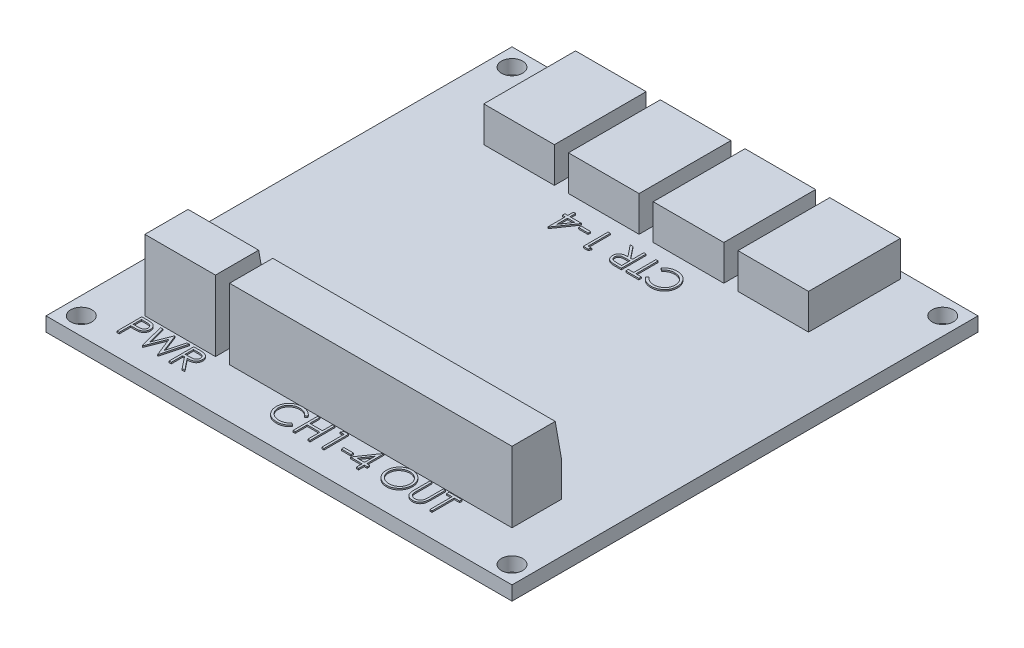
from build123d import *
from OCP.BRepFilletAPI import BRepFilletAPI_MakeChamfer

# Parameters (mm, degrees)
SKIZZE1_W                       = 66
SKIZZE1_H                       = 66
SKIZZE1_R                       = 1.5
AUFSATZ_LINEAR_AUSTRAGEN1_DEPTH = 2
SKIZZE2_W                       = 40
SKIZZE2_H                       = 7
SKIZZE2_W_2                     = 10
AUFSATZ_LINEAR_AUSTRAGEN2_DEPTH = 10
FASE1_SIZE                      = 5
FASE1_SIZE2                     = 0.881634904
SKIZZE3_W                       = 1.346153846
SKIZZE3_H                       = 0.358974359
AUFSATZ_LINEAR_AUSTRAGEN3_DEPTH = 0.2
SKIZZE4_W                       = 10
SKIZZE4_H                       = 13
AUFSATZ_LINEAR_AUSTRAGEN4_DEPTH = 5
SKIZZE5_W                       = 1.346153846
SKIZZE5_H                       = 0.358974359
AUFSATZ_LINEAR_AUSTRAGEN5_DEPTH = 0.2


with BuildPart() as part:
    # Skizze1 → Aufsatz-Linear austragen1 (new body)
    with BuildSketch(Plane(origin=(0, 0, 0), x_dir=(1, 0, 0), z_dir=(0, 1, 0))):
        Rectangle(SKIZZE1_W, SKIZZE1_H)
        with Locations(Location((-30.5, 30.5, 0), (0, 0, 270))):
            Circle(SKIZZE1_R, mode=Mode.SUBTRACT)
        with Locations(Location((-30.5, -30.5, 0), (0, 0, 90))):
            Circle(SKIZZE1_R, mode=Mode.SUBTRACT)
        with Locations(Location((30.5, 30.5, 0), (0, 0, 90))):
            Circle(SKIZZE1_R, mode=Mode.SUBTRACT)
        with Locations(Location((30.5, -30.5, 0), (0, 0, 270))):
            Circle(SKIZZE1_R, mode=Mode.SUBTRACT)
    extrude(amount=AUFSATZ_LINEAR_AUSTRAGEN1_DEPTH)

    # Skizze2 → Aufsatz-Linear austragen2 (add)
    with BuildSketch(Plane(origin=(0, 2, 0), x_dir=(1, 0, 0), z_dir=(0, 1, 0))):
        with Locations((6, -22.5)):
            Rectangle(SKIZZE2_W, SKIZZE2_H)
        with Locations((-21, -22.5)):
            Rectangle(SKIZZE2_W_2, SKIZZE2_H)
    extrude(amount=AUFSATZ_LINEAR_AUSTRAGEN2_DEPTH)

    # Fase1: one chamfer whose edges measure the first distance from different faces: ONE call of the kernel's chamfer builder (chamfer() names one face for all edges)
    fase1_edges_1 = [part.edges().sort_by_distance(p)[0] for p in [
        (6, 12, 19),
    ]]
    fase1_side_1 = [part.faces().sort_by_distance(p)[0] for p in [
        (6, 7, 19),
    ]]
    fase1_edges_2 = [part.edges().sort_by_distance(p)[0] for p in [
        (-21, 12, 19),
    ]]
    fase1_side_2 = [part.faces().sort_by_distance(p)[0] for p in [
        (-21, 7, 19),
    ]]
    fase1 = BRepFilletAPI_MakeChamfer(part.part.solid().wrapped)
    for e in fase1_edges_1:
        fase1.Add(FASE1_SIZE, FASE1_SIZE2, e.wrapped, fase1_side_1[0].wrapped)  # the first distance lies on this face
    for e in fase1_edges_2:
        fase1.Add(FASE1_SIZE, FASE1_SIZE2, e.wrapped, fase1_side_2[0].wrapped)  # the first distance lies on this face
    add(Compound.cast(fase1.Shape()), mode=Mode.REPLACE)

    # Skizze3 → Aufsatz-Linear austragen3 (add)
    # profile 1 of 11: a face of its own
    with BuildSketch(Plane(origin=(0, 2, 0), x_dir=(1, 0, 0), z_dir=(0, 1, 0))):
        with BuildLine():
            Line((-25.905505706, -26.527836459), (-25.219107469, -26.527836459))
            add(Edge.make_bspline(
                [(-25.219107469, -26.527836459), (-25.171896563, -26.527888355), (-25.08143837, -26.527987791), (-24.951723315, -26.531002536), (-24.833913583, -26.535029228), (-24.728263202, -26.540611122), (-24.634447104, -26.547207712), (-24.552889804, -26.556459751), (-24.482950248, -26.566120047), (-24.441043799, -26.575941453), (-24.421931988, -26.580420593)],
                knots=[0, 0, 0, 0, 1.415646017, 2.712440637, 3.8905458, 4.950247383, 5.884950622, 6.709939814, 7.411656543, 8, 8, 8, 8], degree=3))
            add(Edge.make_bspline(
                [(-24.421931988, -26.580420593), (-24.397738455, -26.587042543), (-24.349921477, -26.600130405), (-24.281020434, -26.626344128), (-24.215466589, -26.657426294), (-24.15303503, -26.692850233), (-24.094492947, -26.734135798), (-24.038966906, -26.779609415), (-23.986946926, -26.830320984), (-23.938725534, -26.885701724), (-23.894440737, -26.944821934), (-23.856311054, -27.008564164), (-23.824383827, -27.075855467), (-23.797000555, -27.146649038), (-23.777292101, -27.221539362), (-23.762445201, -27.300006074), (-23.753021574, -27.382040764), (-23.752119012, -27.438100632), (-23.751659553, -27.466638542)],
                knots=[0, 0, 0, 0, 0.999701418, 1.975846123, 2.934577507, 3.890451536, 4.834027766, 5.787354733, 6.749476667, 7.726910423, 8.712836071, 9.690891519, 10.682875813, 11.679750201, 12.712814741, 13.765529915, 14.8625177, 16, 16, 16, 16], degree=3))
            add(Edge.make_bspline(
                [(-23.751659553, -27.466638542), (-23.752080977, -27.495416319), (-23.752905523, -27.551721983), (-23.762801809, -27.634094771), (-23.776132, -27.712813161), (-23.796629052, -27.787702612), (-23.823474726, -27.858318382), (-23.854966778, -27.925739614), (-23.892950309, -27.988819286), (-23.936595138, -28.047786404), (-23.985146733, -28.102696316), (-24.038399671, -28.15315111), (-24.096138964, -28.198855449), (-24.158181112, -28.239911793), (-24.22513096, -28.275368072), (-24.295973114, -28.307125377), (-24.37132333, -28.333796438), (-24.423465844, -28.347826499), (-24.44997686, -28.354959856)],
                knots=[0, 0, 0, 0, 1.121902311, 2.195077645, 3.232258892, 4.234102512, 5.217864754, 6.176164875, 7.132989551, 8.084763148, 9.034132444, 9.988522005, 10.94243251, 11.903244335, 12.886203696, 13.894208494, 14.929344452, 16, 16, 16, 16], degree=3))
            add(Edge.make_bspline(
                [(-24.44997686, -28.354959856), (-24.471904194, -28.359622837), (-24.519959222, -28.369842031), (-24.599101944, -28.381250488), (-24.69124733, -28.390988089), (-24.79626961, -28.398289227), (-24.914074515, -28.404539595), (-25.044725772, -28.409507689), (-25.188479849, -28.412237543), (-25.288751093, -28.412378336), (-25.341102662, -28.412451843)],
                knots=[0, 0, 0, 0, 0.601384939, 1.31797006, 2.144135048, 3.087295005, 4.142315834, 5.309527816, 6.595305764, 8, 8, 8, 8], degree=3))
            Line((-25.341102662, -28.412451843), (-25.591403142, -28.412451843))
            Line((-25.591403142, -28.412451843), (-25.591403142, -30.027836459))
            Line((-25.591403142, -30.027836459), (-25.905505706, -30.027836459))
            Line((-25.905505706, -30.027836459), (-25.905505706, -26.527836459))
        make_face()
        with BuildLine():
            Line((-25.591403142, -26.886810818), (-25.591403142, -28.053477484))
            Line((-25.591403142, -28.053477484), (-24.978622694, -28.061189824))
            add(Edge.make_bspline(
                [(-24.978622694, -28.061189824), (-24.948702768, -28.061205288), (-24.890942968, -28.06123514), (-24.807506745, -28.057249916), (-24.730097457, -28.052649384), (-24.658952882, -28.04591346), (-24.594040947, -28.036392203), (-24.535253419, -28.026780465), (-24.483046136, -28.012875102), (-24.421946934, -27.994152033), (-24.353863586, -27.962219418), (-24.279796038, -27.915869527), (-24.217025452, -27.856788819), (-24.162707155, -27.790360988), (-24.119601277, -27.716461859), (-24.088045285, -27.637392922), (-24.069504127, -27.553965072), (-24.067017933, -27.496876933), (-24.065762117, -27.468040786)],
                knots=[0, 0, 0, 0, 1.160613943, 2.240541288, 3.23993089, 4.169200891, 5.011653406, 5.7853311, 6.478053781, 7.106038997, 8.262395093, 9.384106736, 10.481365981, 11.59014053, 12.70357646, 13.786202915, 14.881775077, 16, 16, 16, 16], degree=3))
            add(Edge.make_bspline(
                [(-24.065762117, -27.468040786), (-24.067024763, -27.439902272), (-24.069534748, -27.38396639), (-24.088190611, -27.30198763), (-24.119539925, -27.223751925), (-24.16299652, -27.15077884), (-24.21573765, -27.084590036), (-24.277036993, -27.027092909), (-24.346750254, -26.980871206), (-24.411598485, -26.951037924), (-24.469199671, -26.932822649), (-24.519231631, -26.920077808), (-24.575722305, -26.909902202), (-24.638690085, -26.901662699), (-24.707646919, -26.894609238), (-24.783185234, -26.889823261), (-24.865018877, -26.887021805), (-24.921829448, -26.88688285), (-24.951278944, -26.886810818)],
                knots=[0, 0, 0, 0, 1.120700087, 2.227813068, 3.331159281, 4.466773991, 5.599788987, 6.693661531, 7.80175334, 8.91857717, 9.525282508, 10.207424825, 10.974604443, 11.810962634, 12.737642355, 13.736264703, 14.826523623, 16, 16, 16, 16], degree=3))
            Line((-24.951278944, -26.886810818), (-25.591403142, -26.886810818))
        make_face(mode=Mode.SUBTRACT)
    # profile 2 of 11: a face of its own
    with BuildSketch(Plane(origin=(0, 2, 0), x_dir=(1, 0, 0), z_dir=(0, 1, 0))):
        Polygon((-23.258069809, -26.527836459), (-22.933450418, -26.527836459), (-22.248454424, -29.09464335), (-21.229724456, -26.527836459), (-21.18415154, -26.527836459), (-20.18435186, -29.077115305), (-19.495850258, -26.527836459), (-19.174736476, -26.527836459), (-20.118446412, -30.027836459), (-20.163318206, -30.027836459), (-21.216403142, -27.350953446), (-22.28210827, -30.027836459), (-22.326980065, -30.027836459), align=None)
    # profile 3 of 11: a face of its own
    with BuildSketch(Plane(origin=(0, 2, 0), x_dir=(1, 0, 0), z_dir=(0, 1, 0))):
        with BuildLine():
            Line((-18.546531347, -26.527836459), (-17.846110674, -26.527836459))
            add(Edge.make_bspline(
                [(-17.846110674, -26.527836459), (-17.799369546, -26.527992045), (-17.709621401, -26.528290787), (-17.581048131, -26.52995655), (-17.464221034, -26.534730906), (-17.359201195, -26.538839489), (-17.26599054, -26.546331431), (-17.184303249, -26.553492078), (-17.114515551, -26.562865738), (-17.0722697, -26.571571161), (-17.053141924, -26.575512741)],
                knots=[0, 0, 0, 0, 1.410062039, 2.707475311, 3.878576406, 4.937260626, 5.877586885, 6.699081471, 7.410979367, 8, 8, 8, 8], degree=3))
            add(Edge.make_bspline(
                [(-17.053141924, -26.575512741), (-17.0275353, -26.581839506), (-16.976868311, -26.59435807), (-16.903918245, -26.620817671), (-16.834403921, -26.651437295), (-16.768614096, -26.687401016), (-16.706878305, -26.728975795), (-16.648559994, -26.775443918), (-16.593394531, -26.826551124), (-16.543612901, -26.883585965), (-16.496673849, -26.943422475), (-16.457085223, -27.008126232), (-16.422958743, -27.075787759), (-16.395788226, -27.147095177), (-16.373910252, -27.221356949), (-16.358484013, -27.299245745), (-16.349232825, -27.380406721), (-16.34829097, -27.435764629), (-16.347813399, -27.463834055)],
                knots=[0, 0, 0, 0, 1.027469482, 2.033020251, 3.019912614, 3.986113645, 4.951240523, 5.91722682, 6.890402269, 7.87763091, 8.8651537, 9.85103654, 10.82876324, 11.815024772, 12.821070561, 13.842952187, 14.906261191, 16, 16, 16, 16], degree=3))
            add(Edge.make_bspline(
                [(-16.347813399, -27.463834055), (-16.349282397, -27.51046916), (-16.352148793, -27.601466327), (-16.378873896, -27.733527209), (-16.422650416, -27.856716524), (-16.482973705, -27.970879161), (-16.559793181, -28.073789807), (-16.652117972, -28.164180262), (-16.759999583, -28.239820175), (-16.860428899, -28.292272979), (-16.949143099, -28.325865888), (-17.022176412, -28.349502247), (-17.101843389, -28.367764212), (-17.187380724, -28.384124344), (-17.279144379, -28.396476038), (-17.376914419, -28.405522633), (-17.48076057, -28.411176682), (-17.55209964, -28.412018686), (-17.588798976, -28.412451843)],
                knots=[0, 0, 0, 0, 1.260483769, 2.459530307, 3.627416485, 4.787058657, 5.939039949, 7.08810263, 8.267026773, 9.491475466, 10.141966685, 10.831826277, 11.566392101, 12.351337768, 13.187381173, 14.07005841, 15.007169909, 16, 16, 16, 16], degree=3))
            Line((-17.588798976, -28.412451843), (-16.302941604, -30.027836459))
            Line((-16.302941604, -30.027836459), (-16.691363078, -30.027836459))
            Line((-16.691363078, -30.027836459), (-17.97722045, -28.412451843))
            Line((-17.97722045, -28.412451843), (-18.232428783, -28.412451843))
            Line((-18.232428783, -28.412451843), (-18.232428783, -30.027836459))
            Line((-18.232428783, -30.027836459), (-18.546531347, -30.027836459))
            Line((-18.546531347, -30.027836459), (-18.546531347, -26.527836459))
        make_face()
        with BuildLine():
            Line((-18.232428783, -26.886810818), (-18.232428783, -28.053477484))
            Line((-18.232428783, -28.053477484), (-17.591603463, -28.058385337))
            add(Edge.make_bspline(
                [(-17.591603463, -28.058385337), (-17.561683424, -28.058398574), (-17.503689867, -28.05842423), (-17.419789202, -28.054430454), (-17.34166909, -28.049887136), (-17.269628338, -28.04293779), (-17.203634763, -28.033981718), (-17.14372135, -28.022778734), (-17.089790298, -28.009726671), (-17.026891759, -27.989525046), (-16.956655228, -27.957519027), (-16.880323768, -27.910953529), (-16.81532143, -27.85238441), (-16.760403568, -27.785410953), (-16.716274136, -27.711774705), (-16.685162082, -27.632358335), (-16.66541964, -27.549166737), (-16.663091094, -27.49198863), (-16.661915963, -27.463132933)],
                knots=[0, 0, 0, 0, 1.146690395, 2.22261258, 3.21895312, 4.145990853, 4.996080663, 5.770904154, 6.481378293, 7.121626537, 8.300444488, 9.431385265, 10.535395872, 11.636531494, 12.74115979, 13.810798291, 14.895190096, 16, 16, 16, 16], degree=3))
            add(Edge.make_bspline(
                [(-16.661915963, -27.463132933), (-16.663118084, -27.434986359), (-16.665500249, -27.379210121), (-16.684949018, -27.29755421), (-16.717838399, -27.22048726), (-16.762160637, -27.148322775), (-16.816159792, -27.08281704), (-16.879477605, -27.026769886), (-16.9503828, -26.980520422), (-17.016653998, -26.950966041), (-17.075888211, -26.932846188), (-17.127317871, -26.920095024), (-17.185429348, -26.909850555), (-17.250504807, -26.901642494), (-17.322266438, -26.89458755), (-17.401077089, -26.889835771), (-17.486413869, -26.887021907), (-17.5455608, -26.886882819), (-17.576178783, -26.886810818)],
                knots=[0, 0, 0, 0, 1.101028733, 2.181837193, 3.264309656, 4.369019818, 5.486613113, 6.575447106, 7.666700264, 8.788928104, 9.402425223, 10.0903467, 10.862060571, 11.710948788, 12.657782767, 13.684531032, 14.801375019, 16, 16, 16, 16], degree=3))
            Line((-17.576178783, -26.886810818), (-18.232428783, -26.886810818))
        make_face(mode=Mode.SUBTRACT)
    # profile 4 of 11: a face of its own
    with BuildSketch(Plane(origin=(0, 2, 0), x_dir=(1, 0, 0), z_dir=(0, 1, 0))):
        with BuildLine():
            Line((-1.965138679, -26.916569253), (-2.239978423, -27.126905791))
            add(Edge.make_bspline(
                [(-2.239978423, -27.126905791), (-2.259584311, -27.103539821), (-2.298531758, -27.057122906), (-2.36119096, -26.991943361), (-2.426492603, -26.9308781), (-2.494411724, -26.87363622), (-2.566170844, -26.822219454), (-2.640031643, -26.773948352), (-2.717229688, -26.730680614), (-2.823981422, -26.678217627), (-2.963629271, -26.623471472), (-3.13942411, -26.577568241), (-3.322935208, -26.548347065), (-3.448132808, -26.545182224), (-3.511813359, -26.543572458)],
                knots=[0, 0, 0, 0, 0.757959112, 1.505699292, 2.245454638, 2.979532153, 3.711538275, 4.438200793, 5.171680507, 5.909471876, 7.393775596, 8.890124382, 10.418191784, 12, 12, 12, 12], degree=3))
            add(Edge.make_bspline(
                [(-3.511813359, -26.543572458), (-3.546896658, -26.54397642), (-3.61673765, -26.544780596), (-3.720386124, -26.555389722), (-3.822099175, -26.570300932), (-3.921810641, -26.592426255), (-4.0193936, -26.620398874), (-4.115486002, -26.653824288), (-4.208696602, -26.695179128), (-4.30031484, -26.740887388), (-4.388094051, -26.792514832), (-4.471149099, -26.848828184), (-4.549177067, -26.909197281), (-4.622239679, -26.973848387), (-4.690411627, -27.042490348), (-4.753198938, -27.115854689), (-4.810384348, -27.193706863), (-4.863101373, -27.27502027), (-4.910314107, -27.359558062), (-4.949843986, -27.447633132), (-4.984849108, -27.537737235), (-5.012548351, -27.630888396), (-5.034472868, -27.726431162), (-5.049600531, -27.82462195), (-5.060089002, -27.92525563), (-5.060889179, -27.993464942), (-5.061292525, -28.027847298)],
                knots=[0, 0, 0, 0, 1.054917814, 2.100044995, 3.131103042, 4.146048494, 5.169673617, 6.183595914, 7.203665975, 8.234915748, 9.262203917, 10.264457458, 11.251630812, 12.227803204, 13.197192746, 14.159520551, 15.12972552, 16.100847026, 17.073214652, 18.039054194, 19.002613845, 19.979014051, 20.95965708, 21.949030935, 22.966165397, 24, 24, 24, 24], degree=3))
            add(Edge.make_bspline(
                [(-5.061292525, -28.027847298), (-5.060030706, -28.079578618), (-5.057553292, -28.181146202), (-5.035504958, -28.329916813), (-5.001999867, -28.472437487), (-4.95178429, -28.607817329), (-4.889865239, -28.737725687), (-4.811624628, -28.859964541), (-4.72100809, -28.976381105), (-4.616733671, -29.084224053), (-4.502327855, -29.182737778), (-4.379579943, -29.26948836), (-4.248795655, -29.341803242), (-4.111419025, -29.401979189), (-3.966392911, -29.448235916), (-3.813978109, -29.48080004), (-3.654506114, -29.50204222), (-3.545536714, -29.504075908), (-3.490078583, -29.505110919)],
                knots=[0, 0, 0, 0, 1.029171465, 2.020641659, 2.987623507, 3.938342917, 4.889210282, 5.84687017, 6.821220943, 7.821438502, 8.827599549, 9.822697543, 10.807740252, 11.797342354, 12.80366471, 13.83203677, 14.896651826, 16, 16, 16, 16], degree=3))
            add(Edge.make_bspline(
                [(-3.490078583, -29.505110919), (-3.428975894, -29.50342214), (-3.308711185, -29.500098217), (-3.132343159, -29.471938968), (-2.963507393, -29.42628105), (-2.802194806, -29.362383128), (-2.64886016, -29.27931784), (-2.5032635, -29.178619963), (-2.365281929, -29.05933163), (-2.282310647, -28.968248502), (-2.239978423, -28.921777586)],
                knots=[0, 0, 0, 0, 1.028121516, 2.023589091, 2.998037872, 3.967518031, 4.937445131, 5.927275754, 6.942489185, 8, 8, 8, 8], degree=3))
            Line((-2.239978423, -28.921777586), (-1.965138679, -29.130010759))
            add(Edge.make_bspline(
                [(-1.965138679, -29.130010759), (-1.987256789, -29.158549211), (-2.031387064, -29.215489417), (-2.102845081, -29.295761127), (-2.178122379, -29.371265163), (-2.257778089, -29.441392784), (-2.34089588, -29.507547249), (-2.428968193, -29.567849081), (-2.520837225, -29.623139965), (-2.616191704, -29.67376689), (-2.714930317, -29.718684137), (-2.816934752, -29.757137904), (-2.921765327, -29.790262794), (-3.029426836, -29.817514731), (-3.140142592, -29.838785815), (-3.253513067, -29.853005489), (-3.369782942, -29.862747404), (-3.448224363, -29.86363532), (-3.487975218, -29.864085278)],
                knots=[0, 0, 0, 0, 0.986787822, 1.968848986, 2.935600012, 3.899624008, 4.868462664, 5.837806735, 6.815139263, 7.798259679, 8.787526145, 9.778297419, 10.776456485, 11.791383307, 12.812564526, 13.85620153, 14.913611965, 16, 16, 16, 16], degree=3))
            add(Edge.make_bspline(
                [(-3.487975218, -29.864085278), (-3.525618885, -29.863823286), (-3.600054575, -29.863305228), (-3.709953326, -29.854913061), (-3.816942907, -29.843463324), (-3.920717533, -29.826223193), (-4.021843508, -29.805878853), (-4.119404092, -29.778607596), (-4.214359303, -29.748058429), (-4.306327644, -29.712153443), (-4.395387343, -29.67163726), (-4.481251155, -29.625845701), (-4.563879587, -29.575163837), (-4.644085008, -29.520708826), (-4.720682592, -29.460731524), (-4.794336117, -29.39606489), (-4.865458593, -29.326926879), (-4.909461278, -29.277072026), (-4.931584993, -29.252005952)],
                knots=[0, 0, 0, 0, 1.114604814, 2.203992996, 3.262667896, 4.300477797, 5.318619304, 6.316056647, 7.298880507, 8.271930387, 9.238335007, 10.195173496, 11.151986948, 12.108099108, 13.064862484, 14.031167946, 15.010108607, 16, 16, 16, 16], degree=3))
            add(Edge.make_bspline(
                [(-4.931584993, -29.252005952), (-4.967020637, -29.208464763), (-5.037464113, -29.121908052), (-5.127589797, -28.981622071), (-5.204737352, -28.835153862), (-5.267113273, -28.681733933), (-5.315876006, -28.521706546), (-5.349657201, -28.354991032), (-5.371608806, -28.181743089), (-5.374119095, -28.063906301), (-5.375395089, -28.004009157)],
                knots=[0, 0, 0, 0, 0.994628077, 1.977248131, 2.950237994, 3.925870899, 4.908910175, 5.911660606, 6.938484602, 8, 8, 8, 8], degree=3))
            add(Edge.make_bspline(
                [(-5.375395089, -28.004009157), (-5.373839896, -27.941053703), (-5.37078015, -27.817192779), (-5.344784354, -27.635418825), (-5.302965558, -27.461267426), (-5.243568669, -27.295063682), (-5.168263318, -27.135933402), (-5.075236704, -26.985092197), (-4.965569562, -26.841575397), (-4.840121994, -26.707560646), (-4.702554659, -26.585021293), (-4.555235845, -26.477215089), (-4.398453898, -26.387497573), (-4.233936046, -26.312501411), (-4.060450365, -26.254856948), (-3.878366996, -26.214503761), (-3.688028081, -26.189386645), (-3.558165655, -26.186211437), (-3.492181948, -26.184598099)],
                knots=[0, 0, 0, 0, 1.032925535, 2.032216505, 3.007276963, 3.968222605, 4.92396291, 5.891752235, 6.871517503, 7.883894988, 8.900124299, 9.891468569, 10.874487609, 11.85992873, 12.854644235, 13.869047385, 14.917252991, 16, 16, 16, 16], degree=3))
            add(Edge.make_bspline(
                [(-3.492181948, -26.184598099), (-3.451967476, -26.185080237), (-3.372366979, -26.186034581), (-3.254614327, -26.195340723), (-3.139972, -26.21085433), (-3.028361018, -26.231970399), (-2.919238401, -26.258177721), (-2.813438161, -26.292318019), (-2.710339474, -26.33135455), (-2.610592566, -26.376313016), (-2.514676015, -26.426779758), (-2.422619697, -26.482195381), (-2.335154838, -26.542491187), (-2.25166599, -26.607154362), (-2.173549779, -26.677552922), (-2.0985883, -26.751750517), (-2.029327222, -26.831884342), (-1.986574027, -26.888289276), (-1.965138679, -26.916569253)],
                knots=[0, 0, 0, 0, 1.096760587, 2.17092713, 3.219439832, 4.250915756, 5.268269357, 6.278326846, 7.281116186, 8.274029601, 9.260640565, 10.235837813, 11.203064059, 12.156899882, 13.114053108, 14.069676657, 15.032185724, 16, 16, 16, 16], degree=3))
        make_face()
    # profile 5 of 11: a face of its own
    with BuildSketch(Plane(origin=(0, 2, 0), x_dir=(1, 0, 0), z_dir=(0, 1, 0))):
        Polygon((-1.247189961, -26.274341689), (-0.933087397, -26.274341689), (-0.933087397, -27.710239125), (0.861784398, -27.710239125), (0.861784398, -26.274341689), (1.175886962, -26.274341689), (1.175886962, -29.774341689), (0.861784398, -29.774341689), (0.861784398, -28.069213484), (-0.933087397, -28.069213484), (-0.933087397, -29.774341689), (-1.247189961, -29.774341689), align=None)
    # profile 6 of 11: a face of its own
    with BuildSketch(Plane(origin=(0, 2, 0), x_dir=(1, 0, 0), z_dir=(0, 1, 0))):
        Polygon((2.50311052, -26.274341689), (3.150245936, -26.274341689), (3.150245936, -29.774341689), (2.836143372, -29.774341689), (2.836143372, -26.633316048), (2.297681834, -26.633316048), align=None)
    # profile 7 of 11: a face of its own
    with BuildSketch(Plane(origin=(0, 2, 0), x_dir=(1, 0, 0), z_dir=(0, 1, 0))):
        with Locations((5.124604911, -28.428187843)):
            Rectangle(SKIZZE3_W, SKIZZE3_H)
    # profile 8 of 11: a face of its own
    with BuildSketch(Plane(origin=(0, 2, 0), x_dir=(1, 0, 0), z_dir=(0, 1, 0))):
        Polygon((7.977469494, -26.184598099), (8.041271577, -26.184598099), (8.041271577, -28.607675022), (8.445117731, -28.607675022), (8.445117731, -28.966649381), (8.041271577, -28.966649381), (8.041271577, -29.774341689), (7.727169013, -29.774341689), (7.727169013, -28.966649381), (6.066912603, -28.966649381), align=None)
        Polygon((7.727169013, -28.607675022), (7.727169013, -27.087642971), (6.683899782, -28.607675022), align=None, mode=Mode.SUBTRACT)
    # profile 9 of 11: a face of its own
    with BuildSketch(Plane(origin=(0, 2, 0), x_dir=(1, 0, 0), z_dir=(0, 1, 0))):
        with BuildLine():
            add(Edge.make_bspline(
                [(12.057297218, -26.184598099), (12.122105324, -26.186239578), (12.249393791, -26.189463579), (12.436468689, -26.214142683), (12.615063784, -26.256838073), (12.786633923, -26.313701055), (12.9491269, -26.389555441), (13.103765792, -26.481240589), (13.250182666, -26.589717048), (13.386404047, -26.714146275), (13.511060998, -26.849529728), (13.620886884, -26.994007639), (13.712929178, -27.146706441), (13.788514965, -27.307167272), (13.847813575, -27.475027239), (13.888732618, -27.651181242), (13.914870768, -27.834487932), (13.917926546, -27.959514797), (13.919476706, -28.022939445)],
                knots=[0, 0, 0, 0, 1.065120563, 2.091984664, 3.0946048, 4.079830382, 5.057816894, 6.036188127, 7.030412546, 8.04752943, 9.064399622, 10.05169764, 11.02544977, 11.989514704, 12.962713494, 13.945757189, 14.957906945, 16, 16, 16, 16], degree=3))
            add(Edge.make_bspline(
                [(13.919476706, -28.022939445), (13.917926773, -28.085896891), (13.914871676, -28.209993312), (13.888702899, -28.392136756), (13.847661899, -28.567227453), (13.789065633, -28.734973105), (13.713840154, -28.895550669), (13.621184983, -29.048537623), (13.512043772, -29.193984121), (13.387836921, -29.330296787), (13.252435879, -29.455294257), (13.107205613, -29.564213133), (12.955412293, -29.657937258), (12.795102585, -29.732720932), (12.628402548, -29.792492852), (12.453820225, -29.833245482), (12.272173671, -29.859532525), (12.148302667, -29.862551041), (12.08534209, -29.864085278)],
                knots=[0, 0, 0, 0, 1.043624062, 2.057103931, 3.04512605, 4.022047818, 4.998200453, 5.980619268, 6.982898556, 8.009068085, 9.034988726, 10.034168286, 11.015286542, 11.987931943, 12.962482838, 13.94673481, 14.956375938, 16, 16, 16, 16], degree=3))
            add(Edge.make_bspline(
                [(12.08534209, -29.864085278), (12.021917771, -29.862535892), (11.896891555, -29.859481638), (11.71335452, -29.833300233), (11.537076776, -29.792358929), (11.368562425, -29.733849493), (11.207717495, -29.658232262), (11.054227413, -29.566027883), (10.908708265, -29.456620742), (10.772366519, -29.332454167), (10.647617321, -29.197282615), (10.538857945, -29.05244836), (10.446632832, -28.900792904), (10.371269499, -28.741895379), (10.31160504, -28.576523937), (10.270900222, -28.403575459), (10.24456427, -28.224035953), (10.241529423, -28.101793055), (10.239989526, -28.039766368)],
                knots=[0, 0, 0, 0, 1.053102029, 2.075944431, 3.073151272, 4.055350789, 5.033113405, 6.020478099, 7.024410459, 8.052272461, 9.079885166, 10.07527673, 11.055994387, 12.023226415, 12.992069828, 13.970394897, 14.97016774, 16, 16, 16, 16], degree=3))
            add(Edge.make_bspline(
                [(10.239989526, -28.039766368), (10.240524162, -27.998133699), (10.241586688, -27.915393576), (10.25437838, -27.792526975), (10.272940082, -27.671636318), (10.299541994, -27.55306537), (10.334333661, -27.437104385), (10.375385689, -27.322953622), (10.425525534, -27.211769898), (10.482206182, -27.103026507), (10.54546799, -26.998418601), (10.615343739, -26.899539018), (10.689379108, -26.805558021), (10.770542501, -26.718911017), (10.856158947, -26.637077361), (10.947617325, -26.561314644), (11.044359569, -26.490939693), (11.146801949, -26.427519352), (11.252420224, -26.370160217), (11.361297002, -26.320938366), (11.471953573, -26.278692305), (11.584908221, -26.244451479), (11.699860993, -26.217419443), (11.817062778, -26.19901209), (11.936420204, -26.186187772), (12.016831523, -26.18513027), (12.057297218, -26.184598099)],
                knots=[0, 0, 0, 0, 1.037015668, 2.060948919, 3.074880161, 4.083647147, 5.086022904, 6.090072063, 7.104153813, 8.122640571, 9.144368836, 10.147691507, 11.138137339, 12.123020368, 13.103399296, 14.087645067, 15.080126199, 16.082011238, 17.087798457, 18.072939717, 19.057185487, 20.037253025, 21.01195951, 21.997135196, 22.992090687, 24, 24, 24, 24], degree=3))
        make_face()
        with BuildLine():
            add(Edge.make_bspline(
                [(12.072721898, -26.543572458), (12.039507264, -26.543977348), (11.973395531, -26.544783258), (11.875110995, -26.555398974), (11.778119061, -26.570528862), (11.682399699, -26.592110383), (11.58835341, -26.621514436), (11.495103569, -26.655355344), (11.403500515, -26.696576435), (11.313846657, -26.743149139), (11.226931582, -26.79469806), (11.14491888, -26.851669827), (11.067596236, -26.912728381), (10.99515297, -26.978016219), (10.927801797, -27.04786582), (10.864217096, -27.121218257), (10.806947514, -27.200170148), (10.754461938, -27.282580554), (10.707494097, -27.368342136), (10.665728743, -27.456551998), (10.631564734, -27.547929685), (10.603702357, -27.641483842), (10.580602547, -27.737066302), (10.565968623, -27.835402151), (10.555236263, -27.935997263), (10.554476418, -28.003979117), (10.55409209, -28.038364125)],
                knots=[0, 0, 0, 0, 1.008559885, 2.007477868, 2.99961109, 3.989939068, 4.984837346, 5.991145699, 7.001802488, 8.033829008, 9.059044045, 10.069351652, 11.065060232, 12.050310815, 13.029377138, 14.011219647, 14.996725999, 15.989392538, 16.977580475, 17.965360261, 18.951710183, 19.937753436, 20.929683414, 21.935841486, 22.955955122, 24, 24, 24, 24], degree=3))
            add(Edge.make_bspline(
                [(10.55409209, -28.038364125), (10.555366952, -28.088926345), (10.557875, -28.188397876), (10.57983257, -28.33416602), (10.613654545, -28.474254306), (10.663511911, -28.607896215), (10.725862526, -28.736240498), (10.802889416, -28.858148603), (10.894148501, -28.973653477), (10.997812028, -29.081948746), (11.111134735, -29.18079455), (11.231467465, -29.267557959), (11.357521072, -29.340968209), (11.489624275, -29.400773281), (11.627071814, -29.448163019), (11.770749365, -29.48064165), (11.919699824, -29.502017105), (12.02123048, -29.504069861), (12.072721898, -29.505110919)],
                knots=[0, 0, 0, 0, 1.032063989, 2.030389145, 3.003944642, 3.970395727, 4.937377036, 5.913328081, 6.909231446, 7.93887556, 8.970685674, 9.976071282, 10.964166581, 11.944589148, 12.933237628, 13.927779006, 14.949070134, 16, 16, 16, 16], degree=3))
            add(Edge.make_bspline(
                [(12.072721898, -29.505110919), (12.107331399, -29.504635415), (12.175972436, -29.503692347), (12.278067958, -29.49419367), (12.37832417, -29.478961801), (12.47660045, -29.457031145), (12.572785261, -29.429583939), (12.667280064, -29.396976211), (12.759078355, -29.356295007), (12.849338192, -29.311347056), (12.935734434, -29.260106898), (13.018209966, -29.205068748), (13.094685946, -29.144100128), (13.167075018, -29.079782315), (13.234702707, -29.010818467), (13.297111691, -28.937298245), (13.354091823, -28.858757588), (13.40655747, -28.776472183), (13.453360732, -28.69047593), (13.494139831, -28.601946252), (13.528735947, -28.511101143), (13.556664452, -28.417809571), (13.578549914, -28.322248722), (13.593629834, -28.224290644), (13.604178272, -28.124131302), (13.60497335, -28.056387446), (13.605374141, -28.022238323)],
                knots=[0, 0, 0, 0, 1.047197238, 2.076906641, 3.100256066, 4.114471768, 5.12198147, 6.126382909, 7.136867548, 8.15857795, 9.17633901, 10.174870724, 11.156907918, 12.133735059, 13.104061851, 14.077631395, 15.04955518, 16.038496417, 17.029181396, 18.010275684, 18.986308667, 19.968651475, 20.955262928, 21.950658345, 22.966943676, 24, 24, 24, 24], degree=3))
            add(Edge.make_bspline(
                [(13.605374141, -28.022238323), (13.604973028, -27.988322819), (13.604177347, -27.921045169), (13.593634872, -27.821584351), (13.578533982, -27.724331139), (13.556771274, -27.629667336), (13.52872112, -27.537568811), (13.49413379, -27.448122063), (13.45334849, -27.360993868), (13.406540266, -27.276399571), (13.353924443, -27.195224833), (13.296430199, -27.117622421), (13.233064851, -27.045049679), (13.165638826, -26.975714985), (13.092467941, -26.911097096), (13.013883647, -26.851174575), (12.930839969, -26.794501301), (12.842912734, -26.743375739), (12.75216878, -26.696161506), (12.659054822, -26.655710503), (12.564625722, -26.621338384), (12.46912161, -26.592021419), (12.371738632, -26.570613389), (12.273134803, -26.555385339), (12.173446544, -26.544786953), (12.106403324, -26.543978574), (12.072721898, -26.543572458)],
                knots=[0, 0, 0, 0, 1.02996197, 2.043119294, 3.035359645, 4.018872909, 4.991431989, 5.957985074, 6.929999688, 7.912076566, 8.892894881, 9.867085534, 10.843653904, 11.817741046, 12.803660682, 13.806313499, 14.818574707, 15.856120519, 16.894564902, 17.924820532, 18.937903209, 19.946497019, 20.957711757, 21.963978472, 22.977135795, 24, 24, 24, 24], degree=3))
        make_face(mode=Mode.SUBTRACT)
    # profile 10 of 11: a face of its own
    with BuildSketch(Plane(origin=(0, 2, 0), x_dir=(1, 0, 0), z_dir=(0, 1, 0))):
        with BuildLine():
            Line((14.637425424, -26.274341689), (14.951527988, -26.274341689))
            Line((14.951527988, -26.274341689), (14.951527988, -28.371396977))
            add(Edge.make_bspline(
                [(14.951527988, -28.371396977), (14.951481244, -28.401077713), (14.951392539, -28.457402024), (14.951985053, -28.537570324), (14.953644421, -28.608842783), (14.954690581, -28.671494131), (14.957017914, -28.725236878), (14.958915961, -28.770362189), (14.961356518, -28.806656392), (14.964289635, -28.827837318), (14.965550424, -28.836941849)],
                knots=[0, 0, 0, 0, 1.528628734, 2.90083645, 4.128790002, 5.200304208, 6.127813768, 6.898992206, 7.526736466, 8, 8, 8, 8], degree=3))
            add(Edge.make_bspline(
                [(14.965550424, -28.836941849), (14.970727882, -28.869788612), (14.980791069, -28.933631341), (15.006437446, -29.024539623), (15.042254947, -29.106471082), (15.08469799, -29.181982373), (15.140630602, -29.248971733), (15.207634137, -29.310683386), (15.288811905, -29.36465519), (15.379072511, -29.414006002), (15.476357748, -29.453671084), (15.575769015, -29.483664449), (15.675811994, -29.501943348), (15.742788159, -29.504059887), (15.776047218, -29.505110919)],
                knots=[0, 0, 0, 0, 1.035780045, 2.013197591, 2.933192213, 3.817615948, 4.702609284, 5.640816605, 6.646850145, 7.73207398, 8.84249596, 9.914020372, 10.964143139, 12, 12, 12, 12], degree=3))
            add(Edge.make_bspline(
                [(15.776047218, -29.505110919), (15.804600959, -29.504037069), (15.861543521, -29.501895571), (15.946149951, -29.48863414), (16.02855006, -29.464733574), (16.10915074, -29.433893816), (16.184701724, -29.393146225), (16.255245166, -29.346075385), (16.318209101, -29.290864509), (16.375667098, -29.229764165), (16.425702034, -29.160824365), (16.469073176, -29.085546227), (16.504599106, -29.00279688), (16.52214263, -28.944642458), (16.531155391, -28.914766368)],
                knots=[0, 0, 0, 0, 0.994687771, 1.983630487, 2.973142513, 3.978332533, 4.983357753, 5.956394766, 6.925816176, 7.893390482, 8.871859704, 9.88551698, 10.913711441, 12, 12, 12, 12], degree=3))
            add(Edge.make_bspline(
                [(16.531155391, -28.914766368), (16.534155517, -28.902417794), (16.540841005, -28.874900194), (16.54708805, -28.828378903), (16.553594575, -28.773489539), (16.558109145, -28.709837726), (16.562510366, -28.637636754), (16.565143439, -28.556510496), (16.566360471, -28.466753536), (16.566723152, -28.404116374), (16.566912603, -28.371396977)],
                knots=[0, 0, 0, 0, 0.558680831, 1.244966039, 2.062412453, 2.990489873, 4.051219941, 5.244515665, 6.560634259, 8, 8, 8, 8], degree=3))
            Line((16.566912603, -28.371396977), (16.566912603, -26.274341689))
            Line((16.566912603, -26.274341689), (16.881015167, -26.274341689))
            Line((16.881015167, -26.274341689), (16.881015167, -28.3882239))
            add(Edge.make_bspline(
                [(16.881015167, -28.3882239), (16.880761047, -28.426322279), (16.880265115, -28.500673582), (16.875964539, -28.609624941), (16.869107539, -28.712977922), (16.859419451, -28.810746419), (16.846582448, -28.902580578), (16.832307227, -28.989285346), (16.814127694, -29.070238339), (16.792894293, -29.146070757), (16.768620745, -29.21825627), (16.737179597, -29.286764885), (16.701755097, -29.353679284), (16.659740444, -29.417987393), (16.612529061, -29.479973946), (16.55907738, -29.539263021), (16.50115322, -29.596802068), (16.43779366, -29.651115134), (16.370043135, -29.700923811), (16.298103177, -29.744721582), (16.222526407, -29.781745199), (16.143509281, -29.812221124), (16.061018078, -29.835135723), (15.975050719, -29.852210879), (15.885411525, -29.861913176), (15.824446869, -29.863355106), (15.793575263, -29.864085278)],
                knots=[0, 0, 0, 0, 1.316592851, 2.569410997, 3.76748051, 4.895814652, 5.963796859, 6.97159953, 7.931736103, 8.829262218, 9.692595152, 10.560224239, 11.431080259, 12.30701507, 13.211635791, 14.121146779, 15.063487852, 16.031507147, 17.00238618, 17.966455255, 18.938106653, 19.907068911, 20.888905087, 21.893141452, 22.933117798, 24, 24, 24, 24], degree=3))
            add(Edge.make_bspline(
                [(15.793575263, -29.864085278), (15.759906161, -29.863300513), (15.693847502, -29.861760807), (15.596509434, -29.852938056), (15.503195238, -29.836319662), (15.412919361, -29.815159718), (15.326910864, -29.785975981), (15.24401742, -29.751877856), (15.165658739, -29.710000596), (15.09056361, -29.663407203), (15.020738854, -29.610982565), (14.956641451, -29.553842391), (14.89816558, -29.492902013), (14.846296884, -29.427501648), (14.800175999, -29.358149941), (14.760445786, -29.284650701), (14.726332542, -29.207032385), (14.708725975, -29.153079184), (14.699825263, -29.125804028)],
                knots=[0, 0, 0, 0, 1.13879206, 2.234305948, 3.301075583, 4.341971843, 5.366689343, 6.369221514, 7.369726634, 8.367512178, 9.355451585, 10.318319045, 11.268648973, 12.207971039, 13.137398894, 14.081662264, 15.030215811, 16, 16, 16, 16], degree=3))
            add(Edge.make_bspline(
                [(14.699825263, -29.125804028), (14.694648105, -29.107171454), (14.683418734, -29.066756985), (14.671393436, -28.999870497), (14.661284354, -28.922855579), (14.651778796, -28.835706961), (14.646169838, -28.738357094), (14.6412524, -28.630848178), (14.637390781, -28.513050216), (14.637413553, -28.430995701), (14.637425424, -28.3882239)],
                knots=[0, 0, 0, 0, 0.625038921, 1.35572334, 2.194682327, 3.136881307, 4.189498639, 5.346923369, 6.617055217, 8, 8, 8, 8], degree=3))
            Line((14.637425424, -28.3882239), (14.637425424, -26.274341689))
        make_face()
    # profile 11 of 11: a face of its own
    with BuildSketch(Plane(origin=(0, 2, 0), x_dir=(1, 0, 0), z_dir=(0, 1, 0))):
        Polygon((17.374604911, -26.633316048), (17.374604911, -26.274341689), (19.2143485, -26.274341689), (19.2143485, -26.633316048), (18.451527988, -26.633316048), (18.451527988, -29.774341689), (18.137425424, -29.774341689), (18.137425424, -26.633316048), align=None)
    extrude(amount=AUFSATZ_LINEAR_AUSTRAGEN3_DEPTH)

    # Skizze4 → Aufsatz-Linear austragen4 (add)
    with BuildSketch(Plane(origin=(0, 2, 0), x_dir=(1, 0, 0), z_dir=(0, 1, 0))):
        with Locations((6, 25.5)):
            Rectangle(SKIZZE4_W, SKIZZE4_H)
        with Locations((18, 25.5)):
            Rectangle(SKIZZE4_W, SKIZZE4_H)
        with Locations((-6, 25.5)):
            Rectangle(SKIZZE4_W, SKIZZE4_H)
        with Locations((-18, 25.5)):
            Rectangle(SKIZZE4_W, SKIZZE4_H)
    extrude(amount=AUFSATZ_LINEAR_AUSTRAGEN4_DEPTH)

    # Skizze5 → Aufsatz-Linear austragen5 (add)
    # profile 1 of 6: a face of its own
    with BuildSketch(Plane(origin=(0, 2, 0), x_dir=(1, 0, 0), z_dir=(0, 1, 0))):
        with BuildLine():
            Line((4.888985995, 14.021833964), (5.163825739, 14.232170502))
            add(Edge.make_bspline(
                [(5.163825739, 14.232170502), (5.183431828, 14.208804841), (5.222379674, 14.16238854), (5.285035923, 14.097204453), (5.350348615, 14.036156181), (5.418226878, 13.97885148), (5.49024157, 13.927593544), (5.563648729, 13.878390362), (5.641115563, 13.835311283), (5.747693426, 13.782684799), (5.887659084, 13.728966457), (6.063243926, 13.682764046), (6.246789744, 13.653629867), (6.371982558, 13.650453034), (6.435660674, 13.648837169)],
                knots=[0, 0, 0, 0, 0.75789156, 1.505565099, 2.245254514, 2.979266606, 3.711207489, 4.440978832, 5.174393176, 5.91211879, 7.394186119, 8.890401545, 10.418332761, 12, 12, 12, 12], degree=3))
            add(Edge.make_bspline(
                [(6.435660674, 13.648837169), (6.470743547, 13.649242954), (6.540583691, 13.650050759), (6.644238458, 13.660632984), (6.746153991, 13.67567772), (6.845951302, 13.6974581), (6.94343224, 13.725814177), (7.039339036, 13.759068291), (7.132542189, 13.800449644), (7.224163276, 13.846149884), (7.311938661, 13.897782536), (7.395005818, 13.954083409), (7.472990106, 14.014496318), (7.546089851, 14.0788785), (7.613568463, 14.14798157), (7.676142796, 14.221029116), (7.733732981, 14.298351024), (7.786279599, 14.379577847), (7.833279234, 14.464308348), (7.874035554, 14.552178573), (7.908486608, 14.642852835), (7.936435477, 14.736136807), (7.958309405, 14.831700286), (7.973450821, 14.929885443), (7.983935552, 15.030520654), (7.984736238, 15.098729758), (7.985139841, 15.133112009)],
                knots=[0, 0, 0, 0, 1.054960097, 2.100129169, 3.131228542, 4.15308236, 5.169990287, 6.183953224, 7.204064171, 8.235355279, 9.262684623, 10.264978336, 11.252191258, 12.228402777, 13.192898315, 14.155264692, 15.119862721, 16.091023151, 17.063429752, 18.032246104, 19.00241354, 19.978852882, 20.959535218, 21.948948728, 22.966123959, 24, 24, 24, 24], degree=3))
            add(Edge.make_bspline(
                [(7.985139841, 15.133112009), (7.983875063, 15.184842175), (7.98139184, 15.286407496), (7.959385507, 15.435194477), (7.925676117, 15.577869335), (7.875982075, 15.713466032), (7.813483934, 15.843114931), (7.735503487, 15.965243773), (7.644846642, 16.081641781), (7.540583378, 16.189489864), (7.426174536, 16.288002197), (7.303427426, 16.374753147), (7.172642926, 16.447067932), (7.035266353, 16.507243905), (6.890240224, 16.553500626), (6.737825426, 16.586064751), (6.578353429, 16.607306931), (6.46938403, 16.609340619), (6.413925899, 16.61037563)],
                knots=[0, 0, 0, 0, 1.029159485, 2.020618137, 2.987588728, 3.942669054, 4.889339625, 5.846988364, 6.821327795, 7.821533711, 8.827683044, 9.822769455, 10.807800696, 11.797391277, 12.803701919, 13.832062008, 14.896664671, 16, 16, 16, 16], degree=3))
            add(Edge.make_bspline(
                [(6.413925899, 16.61037563), (6.35282321, 16.608686851), (6.232558501, 16.605362928), (6.056190475, 16.577203679), (5.887354709, 16.531545761), (5.726042122, 16.467647839), (5.572707476, 16.384582551), (5.427110816, 16.283884673), (5.289129245, 16.164596341), (5.206157963, 16.073513212), (5.163825739, 16.027042297)],
                knots=[0, 0, 0, 0, 1.028121516, 2.023589091, 2.998037872, 3.967518031, 4.937445131, 5.927275754, 6.942489185, 8, 8, 8, 8], degree=3))
            Line((5.163825739, 16.027042297), (4.888985995, 16.23527547))
            add(Edge.make_bspline(
                [(4.888985995, 16.23527547), (4.911104851, 16.263812983), (4.955236615, 16.320751316), (5.026683565, 16.401036951), (5.102002206, 16.476488967), (5.181395867, 16.546714413), (5.264968189, 16.612064301), (5.352682647, 16.672234768), (5.444101751, 16.727893285), (5.539339973, 16.778341191), (5.638402524, 16.823231401), (5.740440462, 16.862465342), (5.8456407, 16.895409801), (5.953173649, 16.923089967), (6.064144208, 16.942858892), (6.177282681, 16.958591932), (6.293642457, 16.967928015), (6.372075782, 16.968871746), (6.411822533, 16.969349989)],
                knots=[0, 0, 0, 0, 0.986880684, 1.969034265, 2.935876267, 3.899990983, 4.864973347, 5.834408638, 6.8063673, 7.789580233, 8.778939794, 9.778051223, 10.776304221, 11.791326552, 12.811423977, 13.855999788, 14.91350973, 16, 16, 16, 16], degree=3))
            add(Edge.make_bspline(
                [(6.411822533, 16.969349989), (6.449466201, 16.969087997), (6.523901891, 16.968569939), (6.633800642, 16.960177772), (6.740790223, 16.948728035), (6.844564849, 16.931487904), (6.945690824, 16.911143563), (7.043251408, 16.883872307), (7.138206619, 16.85332314), (7.230174959, 16.817418154), (7.319234659, 16.776901971), (7.405098471, 16.731110412), (7.487726903, 16.680428547), (7.567932324, 16.625973537), (7.644529908, 16.565996235), (7.718183433, 16.501329601), (7.789305909, 16.43219159), (7.833308594, 16.382336737), (7.855432309, 16.357270662)],
                knots=[0, 0, 0, 0, 1.114604814, 2.203992996, 3.262667896, 4.300477797, 5.318619304, 6.316056647, 7.298880507, 8.271930387, 9.238335007, 10.195173496, 11.151986948, 12.108099108, 13.064862484, 14.031167946, 15.010108607, 16, 16, 16, 16], degree=3))
            add(Edge.make_bspline(
                [(7.855432309, 16.357270662), (7.890865641, 16.313728575), (7.961304524, 16.227170079), (8.051464237, 16.086897323), (8.12838315, 15.940571095), (8.191269168, 15.787343847), (8.239572965, 15.627156012), (8.273533675, 15.460265288), (8.29544847, 15.287005295), (8.297963832, 15.169170167), (8.299242405, 15.109273868)],
                knots=[0, 0, 0, 0, 0.994611881, 1.977215934, 2.950189954, 3.921972279, 4.908960509, 5.911694611, 6.938501887, 8, 8, 8, 8], degree=3))
            add(Edge.make_bspline(
                [(8.299242405, 15.109273868), (8.297680256, 15.046321048), (8.294606824, 14.922465305), (8.268710309, 14.740653759), (8.226545779, 14.566716091), (8.168484941, 14.399983032), (8.091887171, 14.241408565), (7.999159376, 14.090322962), (7.88939583, 13.94684959), (7.763975057, 13.812822768), (7.626400474, 13.69028668), (7.479083555, 13.582479623), (7.322301109, 13.492762332), (7.157783391, 13.417766109), (6.984297673, 13.360121662), (6.802214314, 13.319768471), (6.611875396, 13.294651356), (6.482012971, 13.291476148), (6.416029264, 13.28986281)],
                knots=[0, 0, 0, 0, 1.032901378, 2.032168977, 3.007206631, 3.966850309, 4.924221947, 5.891988639, 6.871730993, 7.884084801, 8.900290346, 9.89161143, 10.874607481, 11.860025555, 12.854717796, 13.869097222, 14.917278314, 16, 16, 16, 16], degree=3))
            add(Edge.make_bspline(
                [(6.416029264, 13.28986281), (6.375814845, 13.290345007), (6.296214453, 13.291299468), (6.17846103, 13.300604752), (6.063821537, 13.316121514), (5.951977063, 13.337268282), (5.842743127, 13.363570798), (5.736610635, 13.396505021), (5.633883686, 13.436324675), (5.533869589, 13.480642963), (5.437850695, 13.531399368), (5.345874764, 13.586569297), (5.258688623, 13.647215138), (5.175725522, 13.712452391), (5.097369022, 13.782782917), (5.022443156, 13.857024552), (4.953172635, 13.9371467), (4.910420708, 13.993553201), (4.888985995, 14.021833964)],
                knots=[0, 0, 0, 0, 1.096566765, 2.170543479, 3.218870886, 4.250164525, 5.273529809, 6.281496242, 7.278154839, 8.276706968, 9.263143576, 10.238168486, 11.199979644, 12.157579042, 13.114563119, 14.070017788, 15.032356758, 16, 16, 16, 16], degree=3))
        make_face()
    # profile 2 of 6: a face of its own
    with BuildSketch(Plane(origin=(0, 2, 0), x_dir=(1, 0, 0), z_dir=(0, 1, 0))):
        Polygon((4.574883431, 13.738580759), (4.574883431, 13.3796064), (2.735139841, 13.3796064), (2.735139841, 13.738580759), (3.497960354, 13.738580759), (3.497960354, 16.8796064), (3.812062918, 16.8796064), (3.812062918, 13.738580759), align=None)
    # profile 3 of 6: a face of its own
    with BuildSketch(Plane(origin=(0, 2, 0), x_dir=(1, 0, 0), z_dir=(0, 1, 0))):
        with BuildLine():
            Line((2.106934713, 13.3796064), (1.40651404, 13.3796064))
            add(Edge.make_bspline(
                [(1.40651404, 13.3796064), (1.359772911, 13.379761986), (1.270024767, 13.380060728), (1.141451497, 13.381726491), (1.0246244, 13.386500846), (0.91960456, 13.39060943), (0.826393905, 13.398101371), (0.744706615, 13.405262018), (0.674918917, 13.414635679), (0.632673066, 13.423341102), (0.61354529, 13.427282682)],
                knots=[0, 0, 0, 0, 1.410062039, 2.707475311, 3.878576406, 4.937260626, 5.877586885, 6.699081471, 7.410979367, 8, 8, 8, 8], degree=3))
            add(Edge.make_bspline(
                [(0.61354529, 13.427282682), (0.587938235, 13.433608746), (0.537270392, 13.446125924), (0.464326581, 13.472595688), (0.39478918, 13.503177816), (0.328912838, 13.539372014), (0.266714815, 13.580567098), (0.20820138, 13.626928672), (0.154157081, 13.678853962), (0.102659107, 13.734192018), (0.057691538, 13.795352189), (0.017208797, 13.85923076), (-0.016775077, 13.927057553), (-0.043516593, 13.998490464), (-0.06593479, 14.072828772), (-0.08100191, 14.150807042), (-0.090385977, 14.232171571), (-0.091313123, 14.287532857), (-0.091783236, 14.315603996)],
                knots=[0, 0, 0, 0, 1.027276577, 2.032638556, 3.019345632, 3.985365262, 4.957888996, 5.923693931, 6.890056973, 7.876427719, 8.865527834, 9.843495157, 10.821038291, 11.815616373, 12.812734995, 13.843357168, 14.906466538, 16, 16, 16, 16], degree=3))
            add(Edge.make_bspline(
                [(-0.091783236, 14.315603996), (-0.090314276, 14.362239154), (-0.087447954, 14.453236427), (-0.060722318, 14.585296558), (-0.016947746, 14.708488614), (0.043382718, 14.822641153), (0.120175641, 14.925589173), (0.212463274, 15.015705945), (0.319774307, 15.091813665), (0.420142862, 15.144030269), (0.508845246, 15.17762867), (0.582084916, 15.201387302), (0.66203768, 15.219434279), (0.747556494, 15.235836459), (0.839301915, 15.24835264), (0.937089189, 15.257241508), (1.041162887, 15.262957117), (1.112502649, 15.263792192), (1.149202341, 15.264221784)],
                knots=[0, 0, 0, 0, 1.260402266, 2.459371274, 3.627181936, 4.786749125, 5.93865593, 7.087644312, 8.261344208, 9.485713728, 10.136162886, 10.825977872, 11.566646758, 12.35154167, 13.181268117, 14.0701832, 15.007234106, 16, 16, 16, 16], degree=3))
            Line((1.149202341, 15.264221784), (-0.136655031, 16.8796064))
            Line((-0.136655031, 16.8796064), (0.251766444, 16.8796064))
            Line((0.251766444, 16.8796064), (1.537623816, 15.264221784))
            Line((1.537623816, 15.264221784), (1.792832149, 15.264221784))
            Line((1.792832149, 15.264221784), (1.792832149, 16.8796064))
            Line((1.792832149, 16.8796064), (2.106934713, 16.8796064))
            Line((2.106934713, 16.8796064), (2.106934713, 13.3796064))
        make_face()
        with BuildLine():
            Line((1.792832149, 13.738580759), (1.792832149, 14.905247425))
            Line((1.792832149, 14.905247425), (1.152006828, 14.910155278))
            add(Edge.make_bspline(
                [(1.152006828, 14.910155278), (1.122086786, 14.910168522), (1.064093221, 14.910194193), (0.980192607, 14.906200314), (0.902072322, 14.901657346), (0.83003215, 14.894706832), (0.764036669, 14.885754599), (0.70412947, 14.874539095), (0.650178167, 14.861527829), (0.587455526, 14.84118371), (0.516610199, 14.81034191), (0.441204878, 14.762519019), (0.375265085, 14.70468428), (0.320443428, 14.637714757), (0.27641061, 14.563766562), (0.245825896, 14.484513254), (0.225670747, 14.401203545), (0.223449348, 14.34400143), (0.222319328, 14.314902874)],
                knots=[0, 0, 0, 0, 1.146399208, 2.222048177, 3.218135709, 4.144938032, 4.994811973, 5.769438708, 6.479732432, 7.119818093, 8.294689872, 9.430121864, 10.527913442, 11.641375077, 12.733452768, 13.811150417, 14.886538365, 16, 16, 16, 16], degree=3))
            add(Edge.make_bspline(
                [(0.222319328, 14.314902874), (0.223506565, 14.286750796), (0.225859235, 14.230963649), (0.245504982, 14.149476516), (0.277583376, 14.071992947), (0.321490465, 13.999579167), (0.376137544, 13.934333329), (0.439789085, 13.878678535), (0.510947224, 13.832442119), (0.576915449, 13.80193522), (0.636310084, 13.783984912), (0.687641625, 13.770954804), (0.746147564, 13.761829106), (0.811139294, 13.753435903), (0.882902317, 13.746328145), (0.961480367, 13.741610366), (1.046817259, 13.738790541), (1.105964174, 13.738652313), (1.136582149, 13.738580759)],
                knots=[0, 0, 0, 0, 1.100596872, 2.180981401, 3.259506136, 4.371595435, 5.481727359, 6.576991111, 7.667816242, 8.793363246, 9.406619729, 10.09427138, 10.864108636, 11.721733836, 12.6590937, 13.685439239, 14.801845161, 16, 16, 16, 16], degree=3))
            Line((1.136582149, 13.738580759), (1.792832149, 13.738580759))
        make_face(mode=Mode.SUBTRACT)
    # profile 4 of 6: a face of its own
    with BuildSketch(Plane(origin=(0, 2, 0), x_dir=(1, 0, 0), z_dir=(0, 1, 0))):
        Polygon((-2.630545255, 13.3796064), (-3.277680672, 13.3796064), (-3.277680672, 16.8796064), (-2.963578108, 16.8796064), (-2.963578108, 13.738580759), (-2.425116569, 13.738580759), align=None)
    # profile 5 of 6: a face of its own
    with BuildSketch(Plane(origin=(0, 2, 0), x_dir=(1, 0, 0), z_dir=(0, 1, 0))):
        with Locations((-5.252039646, 15.533452554)):
            Rectangle(SKIZZE5_W, SKIZZE5_H)
    # profile 6 of 6: a face of its own
    with BuildSketch(Plane(origin=(0, 2, 0), x_dir=(1, 0, 0), z_dir=(0, 1, 0))):
        Polygon((-8.104904229, 13.28986281), (-8.168706313, 13.28986281), (-8.168706313, 15.712939733), (-8.572552467, 15.712939733), (-8.572552467, 16.071914092), (-8.168706313, 16.071914092), (-8.168706313, 16.8796064), (-7.854603749, 16.8796064), (-7.854603749, 16.071914092), (-6.194347338, 16.071914092), align=None)
        Polygon((-7.854603749, 15.712939733), (-7.854603749, 14.192907682), (-6.811334518, 15.712939733), align=None, mode=Mode.SUBTRACT)
    extrude(amount=AUFSATZ_LINEAR_AUSTRAGEN5_DEPTH)


solid = part.part
